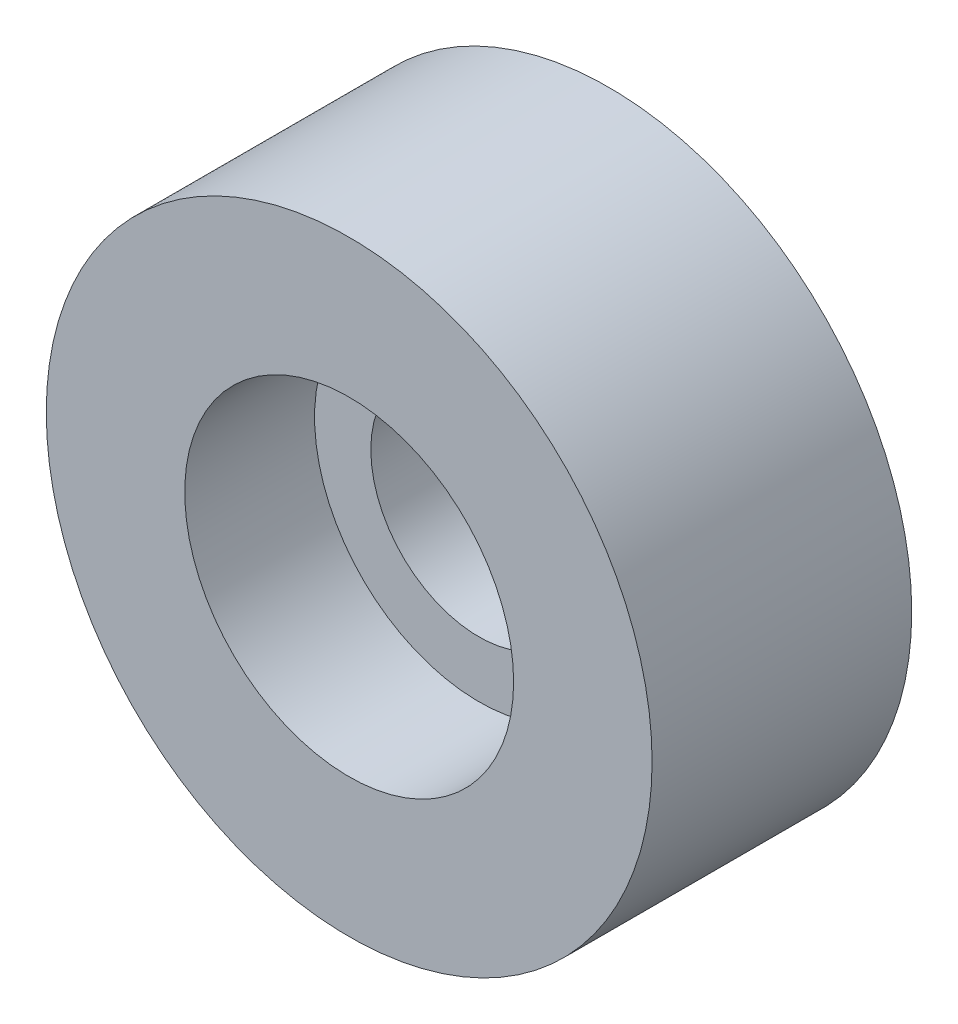
from build123d import *

# Parameters (mm, degrees)
SKETCH_1_R          = 3.5
EXTRUDE_1_DEPTH     = 3
SKETCH_2_R          = 1.9
CUT_EXTRUDE_1_DEPTH = 1.5
SKETCH_3_R          = 1.25
CUT_EXTRUDE_2_DEPTH = 6.172040216
SKETCH1_R           = 1.25
SKETCH1_R_2         = 1.05
BOSS_EXTRUDE1_DEPTH = 1
SKETCH3_R           = 2
SKETCH3_R_2         = 1.25
BOSS_EXTRUDE2_DEPTH = 1


with BuildPart() as part:
    # 草图1 → 凸台-拉伸1 (new body)
    with BuildSketch(Plane.XY):
        Circle(SKETCH_1_R)
    extrude(amount=EXTRUDE_1_DEPTH)

    # 草图2 → 切除-拉伸1 (cut)
    with BuildSketch(Plane.XY.offset(3)):
        Circle(SKETCH_2_R)
    extrude(amount=-CUT_EXTRUDE_1_DEPTH, mode=Mode.SUBTRACT)

    # 草图3 → 切除-拉伸2 (cut, through all)
    with BuildSketch(Plane.XY.offset(1.5)):
        Circle(SKETCH_3_R)
    extrude(amount=-CUT_EXTRUDE_2_DEPTH, mode=Mode.SUBTRACT)



with BuildPart() as body_2:
    # Sketch1 → Boss-Extrude1 (new body)
    with BuildSketch(Plane(origin=(0, 0, 0), x_dir=(-1, 0, 0), z_dir=(0, 0, -1))):
        with Locations(Location((0, 0, 0), (0, 0, 180))):
            Circle(SKETCH1_R)
        Circle(SKETCH1_R_2, mode=Mode.SUBTRACT)
    extrude(amount=BOSS_EXTRUDE1_DEPTH)


with BuildPart() as part_1:
    add(part.part)

    add(body_2.part)  # Boss-Extrude2 merges body 2
    # Sketch3 → Boss-Extrude2 (add)
    with BuildSketch(Plane(origin=(0, 0, 0), x_dir=(-1, 0, 0), z_dir=(0, 0, -1))):
        with Locations(Location((0, 0, 0), (0, 0, 180))):
            Circle(SKETCH3_R)
        with Locations(Location((0, 0, 0), (0, 0, 180))):
            Circle(SKETCH3_R_2, mode=Mode.SUBTRACT)
    extrude(amount=BOSS_EXTRUDE2_DEPTH)


solid = part_1.part
